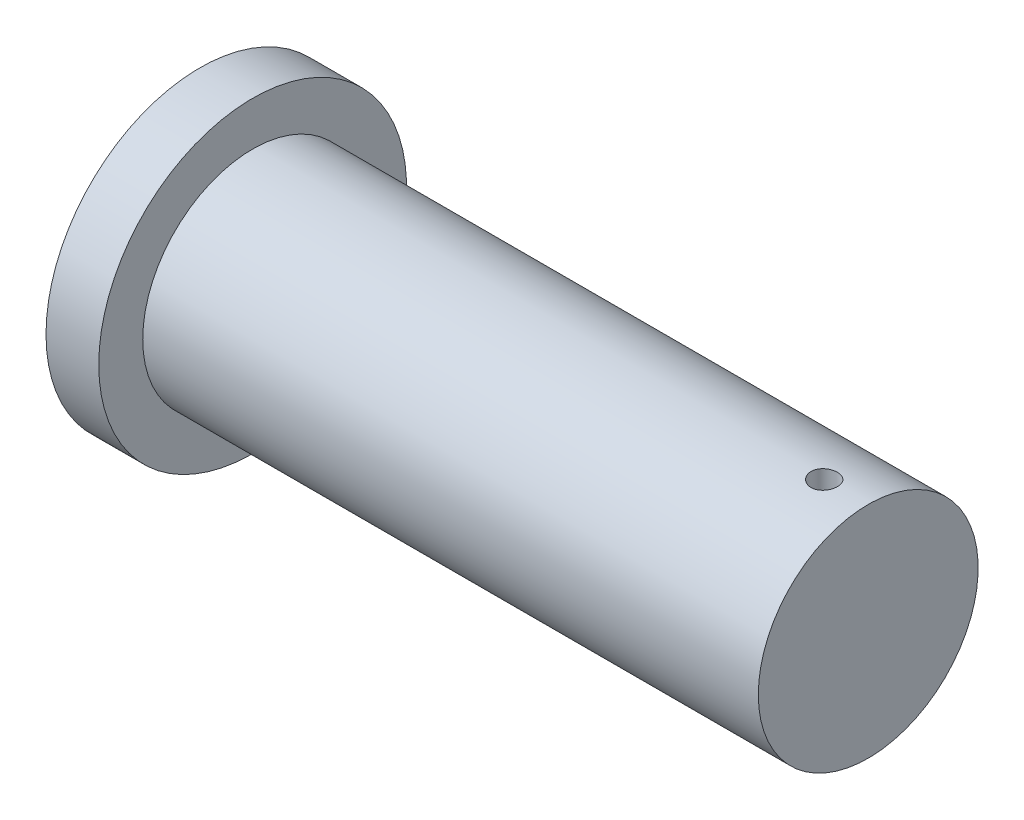
from build123d import *

# Parameters (mm, degrees)
CUT_EXTRUDE1_DEPTH      = 1599.561853667
CUT_EXTRUDE1_DEPTH_BACK = 1599.561853667
SKETCH2_R               = 30


with BuildPart() as part:
    # Sketch1 → Revolve1 (revolve)
    with BuildSketch(Plane.XY, mode=Mode.PRIVATE) as revolve1_sk:
        Polygon((0, 0), (0, 250), (-1400, 250), (-1400, 350), (-1520, 350), (-1520, 0), align=None)
    revolve(revolve1_sk.sketch.rotate(Axis((-1520, 0, 0), (1, 0, 0)), 90), axis=Axis((-1520, 0, 0), (1, 0, 0)))

    # Sketch2 → Cut-Extrude1 (cut, two sides: drawn at the far end of the back side and taken through both)
    with BuildSketch(Plane(origin=(0, 0, 0), x_dir=(1, 0, 0), z_dir=(0, 1, 0)).offset(-CUT_EXTRUDE1_DEPTH_BACK)):
        with Locations(Location((-100, 0, 0), (0, 0, 270))):
            Circle(SKETCH2_R)
    extrude(amount=CUT_EXTRUDE1_DEPTH + CUT_EXTRUDE1_DEPTH_BACK, mode=Mode.SUBTRACT)


solid = part.part
